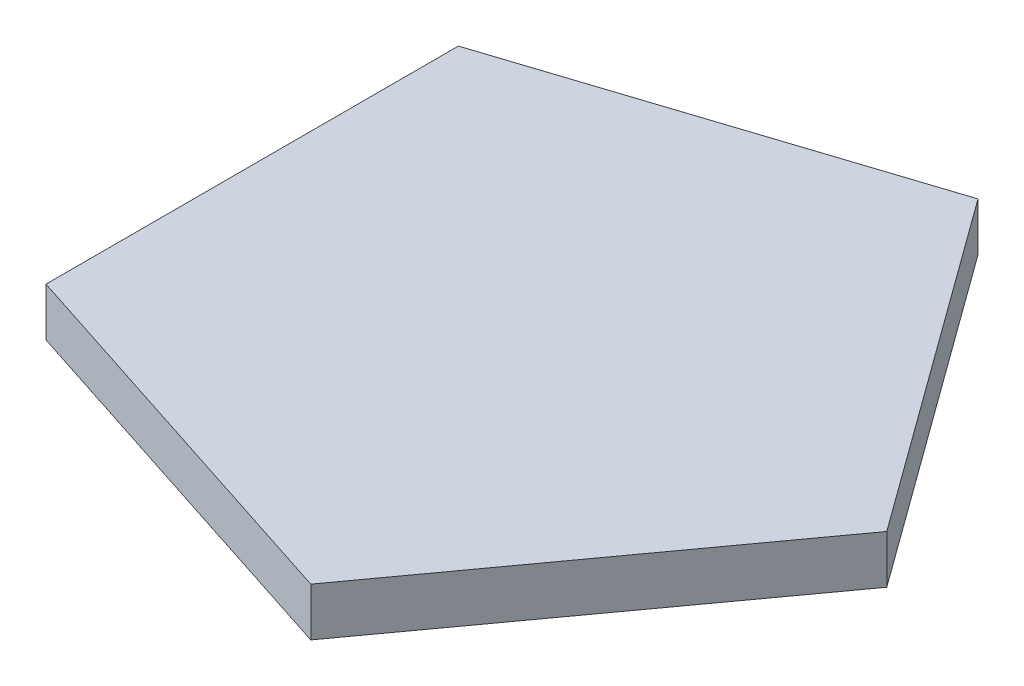
from build123d import *

# Parameters (mm, degrees)
BOSS_EXTRUDE1_DEPTH = 7.5


with BuildPart() as part:
    # Sketch1 → Boss-Extrude1 (new body)
    with BuildSketch(Plane(origin=(0, 0, 0), x_dir=(1, 0, 0), z_dir=(0, 1, 0))):
        Polygon((54.441651735, 0), (16.823395588, 51.77708764), (-44.044221455, 32), (-44.044221455, -32), (16.823395588, -51.77708764), align=None)
    extrude(amount=BOSS_EXTRUDE1_DEPTH)


solid = part.part
